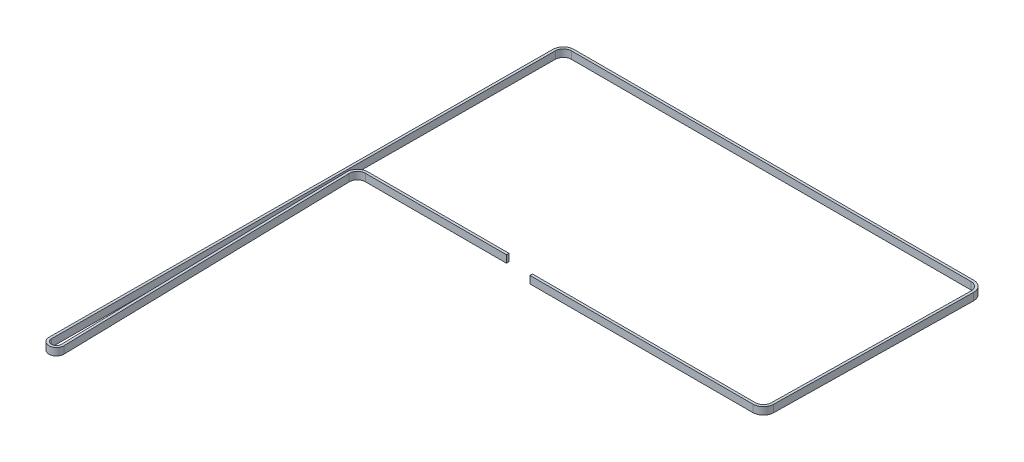
from build123d import *

# Parameters (mm, degrees)
EXTRUDE_THIN1_DEPTH = 6


with BuildPart() as part:
    # Sketch1 → Extrude-Thin1 (new body)
    with BuildSketch(Plane.XZ.offset(-506)):
        with BuildLine():
            Line((-21.192485275, -17.077366054), (159.500009042, -17.077366054))
            ThreePointArc((159.500009042, -17.077366054), (165.46311011, -19.520021284), (167.998964116, -25.444089427))
            Line((167.998964116, -25.444089427), (170.498955066, -184.866722883))
            ThreePointArc((170.498955066, -184.866722883), (168.057344942, -190.963100892), (162, -193.5))
            Line((162, -193.5), (-162, -193.5))
            ThreePointArc((-162, -193.5), (-167.994478635, -191.026294541), (-170.499880912, -185.044994328))
            Line((-170.499880912, -185.044994328), (-172.649915938, 221.118239298))
            ThreePointArc((-172.649915938, 221.118239298), (-166.598052627, 227.149775118), (-160.651533501, 221.014354663))
            Line((-160.651533501, 221.014354663), (-165.998338708, -15.430425982))
            ThreePointArc((-165.998338708, -15.430425982), (-164.147858351, -20.121318086), (-159.5, -22.077375097))
            Line((-159.5, -22.077375097), (-45.192485275, -22.077375097))
            Line((-45.192485275, -22.077375097), (-45.192485275, -24.077375097))
            Line((-45.192485275, -24.077375097), (-159.499998361, -24.077375097))
            ThreePointArc((-159.499998361, -24.077375097), (-165.577967625, -21.519455227), (-167.997827562, -15.385211808))
            Line((-167.997827562, -15.385211808), (-162.651022334, 221.059569775))
            ThreePointArc((-162.651022334, 221.059569775), (-166.615368418, 225.149850079), (-170.649943958, 221.128826199))
            Line((-170.649943958, 221.128826199), (-168.499908932, -185.034407427))
            ThreePointArc((-168.499908932, -185.034407427), (-166.584013074, -189.608342884), (-162, -191.5))
            Line((-162, -191.5), (162, -191.5))
            ThreePointArc((162, -191.5), (166.632088112, -189.560017513), (168.499200897, -184.898079914))
            Line((168.499200897, -184.898079914), (165.999209981, -25.475448634))
            ThreePointArc((165.999209981, -25.475448634), (164.060027506, -20.945278877), (159.500009042, -19.077366054))
            Line((159.500009042, -19.077366054), (-21.192485275, -19.077366054))
            Line((-21.192485275, -19.077366054), (-21.192485275, -17.077366054))
        make_face()
    extrude(amount=EXTRUDE_THIN1_DEPTH)


solid = part.part
